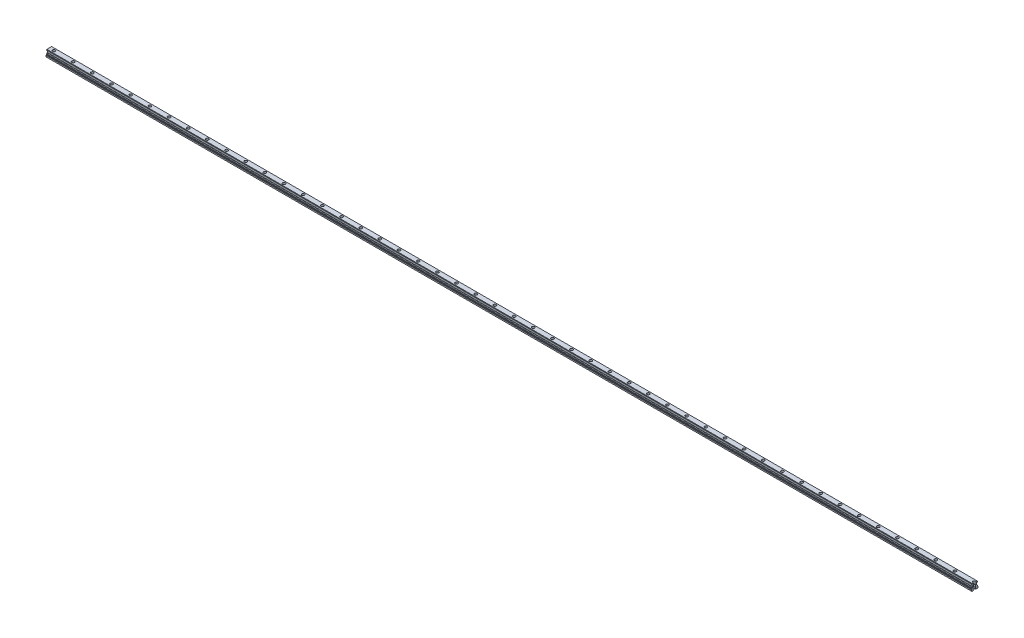
from build123d import *

# Parameters (mm, degrees)
BOSS_EXTRUDE5_DEPTH = 2897
SKETCH8_R           = 4.25
CUT_EXTRUDE1_DEPTH  = 9
SKETCH9_R           = 3
CUT_EXTRUDE2_DEPTH  = 17
LPATTERN1_COUNT     = 50
LPATTERN1_PITCH     = 60


with BuildPart() as part:
    # Sketch7 → Boss-Extrude5 (new body)
    with BuildSketch(Plane(origin=(58.5, 0, 0), x_dir=(0, 0, -1), z_dir=(1, 0, 0))):
        with BuildLine():
            Line((-7.709038211, 8.883084864), (-8.5, 8.601077183))
            Line((-8.5, 8.601077183), (-8.5, 6.104700538))
            ThreePointArc((-8.5, 6.104700538), (-8.566987298, 5.854700538), (-8.75, 5.671687836))
            Line((-8.75, 5.671687836), (-10, 4.95))
            Line((-10, 4.95), (-10, 1))
            Line((-10, 1), (-9, 0))
            Line((-9, 0), (-4, 0))
            Line((-4, 0), (-3.5, 0.5))
            Line((-3.5, 0.5), (3.5, 0.5))
            Line((3.5, 0.5), (4, 0))
            Line((4, 0), (9, 0))
            Line((9, 0), (10, 1))
            Line((10, 1), (10, 4.95))
            Line((10, 4.95), (8.75, 5.671687836))
            ThreePointArc((8.75, 5.671687836), (8.566987298, 5.854700538), (8.5, 6.104700538))
            Line((8.5, 6.104700538), (8.5, 8.46691323))
            Line((8.5, 8.46691323), (8.084678947, 8.882234283))
            ThreePointArc((8.084678947, 8.882234283), (6.941822875, 9.249266637), (6.503340774, 10.366659226))
            Line((6.503340774, 10.366659226), (6, 10.87))
            Line((6, 10.87), (6, 14.93))
            Line((6, 14.93), (6.503340774, 15.433340774))
            ThreePointArc((6.503340774, 15.433340774), (6.813545517, 16.412959034), (7.709038211, 16.916915136))
            Line((7.709038211, 16.916915136), (8.5, 17.198922817))
            Line((8.5, 17.198922817), (8.5, 19.3))
            Line((8.5, 19.3), (7.5, 20.3))
            Line((7.5, 20.3), (-7.5, 20.3))
            Line((-7.5, 20.3), (-8.5, 19.3))
            Line((-8.5, 19.3), (-8.5, 17.33308677))
            Line((-8.5, 17.33308677), (-8.084678947, 16.917765717))
            ThreePointArc((-8.084678947, 16.917765717), (-6.941822875, 16.550733363), (-6.503340774, 15.433340774))
            Line((-6.503340774, 15.433340774), (-6, 14.93))
            Line((-6, 14.93), (-6, 10.87))
            Line((-6, 10.87), (-6.503340774, 10.366659226))
            ThreePointArc((-6.503340774, 10.366659226), (-6.813545517, 9.387040966), (-7.709038211, 8.883084864))
        make_face()
    extrude(amount=BOSS_EXTRUDE5_DEPTH)

    # Sketch8 → Cut-Extrude1 (cut)
    with BuildSketch(Plane(origin=(0, 20.3, 0), x_dir=(1, 0, 0), z_dir=(0, 1, 0))):
        with Locations(Location((73.471629952, 0, 0), (0, 0, 270))):
            Circle(SKETCH8_R)
    cut_extrude1 = extrude(amount=-CUT_EXTRUDE1_DEPTH, mode=Mode.SUBTRACT)

    # Sketch9 → Cut-Extrude2 (cut)
    with BuildSketch(Plane(origin=(0, 11.3, 0), x_dir=(1, 0, 0), z_dir=(0, 1, 0))):
        with Locations(Location((73.471629952, 0, 0), (0, 0, 270))):
            Circle(SKETCH9_R)
    cut_extrude2 = extrude(amount=-CUT_EXTRUDE2_DEPTH, mode=Mode.SUBTRACT)

    # LPattern1: Cut-Extrude1, Cut-Extrude2 ×50
    with Locations(*[(i * LPATTERN1_PITCH, 0, 0) for i in range(1, LPATTERN1_COUNT)]):
        add(cut_extrude1, mode=Mode.SUBTRACT)
        add(cut_extrude2, mode=Mode.SUBTRACT)


solid = part.part
